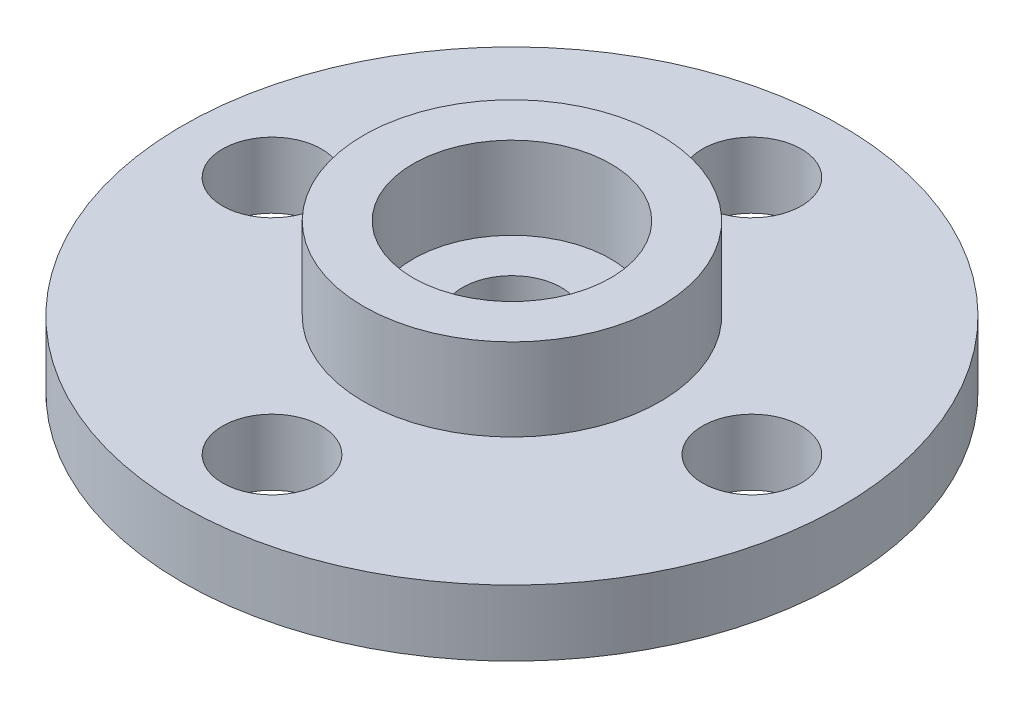
from build123d import *

# Parameters (mm, degrees)
CROQUIS1_R              = 10
SALIENTE_EXTRUIR1_DEPTH = 2
CROQUIS2_R              = 4.5
SALIENTE_EXTRUIR2_DEPTH = 2.5
CROQUIS3_R              = 3
CORTAR_EXTRUIR1_DEPTH   = 2.5
CROQUIS4_R              = 1.5
CORTAR_EXTRUIR2_DEPTH   = 2.5


with BuildPart() as part:
    # Croquis1 → Saliente-Extruir1 (new body)
    with BuildSketch(Plane(origin=(0, 0, 0), x_dir=(1, 0, 0), z_dir=(0, 1, 0))):
        with Locations(Location((0, 0, 0), (0, 0, 270))):
            Circle(CROQUIS1_R)
    extrude(amount=SALIENTE_EXTRUIR1_DEPTH)

    # Croquis2 → Saliente-Extruir2 (add)
    with BuildSketch(Plane(origin=(0, 2, 0), x_dir=(1, 0, 0), z_dir=(0, 1, 0))):
        with Locations(Location((0, 0, 0), (0, 0, 270))):
            Circle(CROQUIS2_R)
    extrude(amount=SALIENTE_EXTRUIR2_DEPTH)

    # Croquis3 → Cortar-Extruir1 (cut)
    with BuildSketch(Plane(origin=(0, 4.5, 0), x_dir=(1, 0, 0), z_dir=(0, 1, 0))):
        with Locations(Location((0, 0, 0), (0, 0, 270))):
            Circle(CROQUIS3_R)
    extrude(amount=-CORTAR_EXTRUIR1_DEPTH, mode=Mode.SUBTRACT)

    # Croquis4 → Cortar-Extruir2 (cut)
    with BuildSketch(Plane(origin=(0, 2, 0), x_dir=(1, 0, 0), z_dir=(0, 1, 0))):
        with Locations(Location((0, 0, 0), (0, 0, 270))):
            Circle(CROQUIS4_R)
        with Locations(Location((0, 7.28, 0), (0, 0, 270))):
            Circle(CROQUIS4_R)
        with Locations(Location((7.28, 0, 0), (0, 0, 270))):
            Circle(CROQUIS4_R)
        with Locations(Location((0, -7.28, 0), (0, 0, 270))):
            Circle(CROQUIS4_R)
        with Locations(Location((-7.28, 0, 0), (0, 0, 270))):
            Circle(CROQUIS4_R)
    extrude(amount=-CORTAR_EXTRUIR2_DEPTH, mode=Mode.SUBTRACT)


solid = part.part
